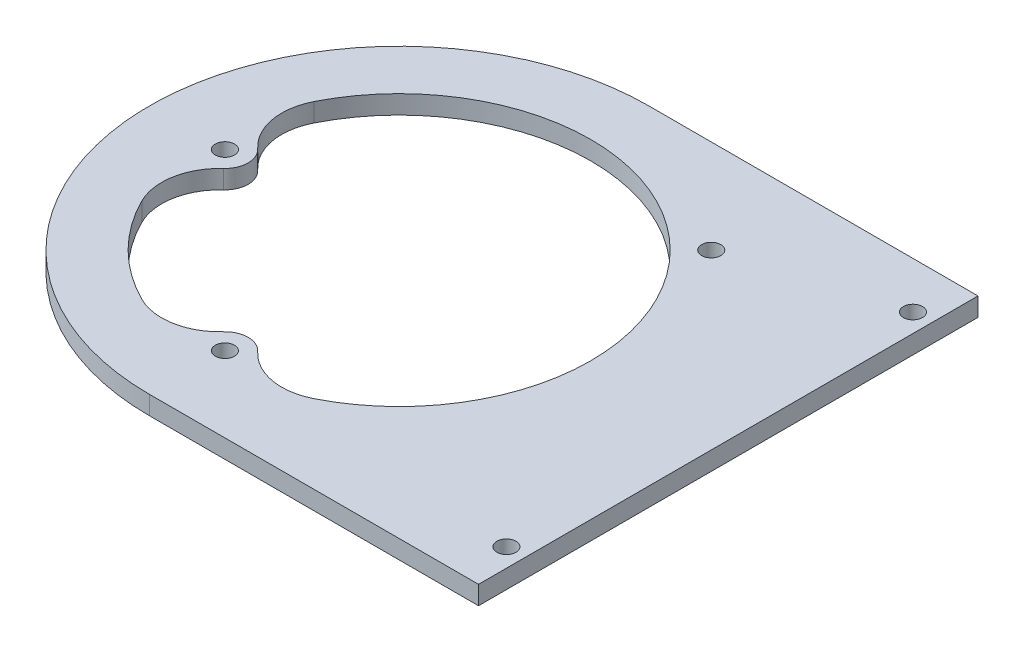
from build123d import *

# Parameters (mm, degrees)
SKETCH1_R           = 1.65
BOSS_EXTRUDE1_DEPTH = 3.2
FILLET1_R           = 10


with BuildPart() as part:
    # Sketch1 → Boss-Extrude1 (new body)
    with BuildSketch(Plane(origin=(0, 0, 0), x_dir=(1, 0, 0), z_dir=(0, 1, 0))):
        with BuildLine():
            Line((0, -43), (56.67, -43))
            Line((56.67, -43), (56.67, 43))
            Line((56.67, 43), (0, 43))
            ThreePointArc((0, 43), (-43, 0), (0, -43))
        make_face()
        with Locations(Location((26.870057685, 26.870057685, 0), (0, 0, 270))):
            Circle(SKETCH1_R, mode=Mode.SUBTRACT)
        with Locations(Location((0, -30, 0), (0, 0, 270))):
            Circle(SKETCH1_R, mode=Mode.SUBTRACT)
        with Locations(Location((53.47, 35, 0), (0, 0, 270))):
            Circle(SKETCH1_R, mode=Mode.SUBTRACT)
        with Locations(Location((53.47, -35, 0), (0, 0, 90))):
            Circle(SKETCH1_R, mode=Mode.SUBTRACT)
        with Locations(Location((-30, 0, 0), (0, 0, 90))):
            Circle(SKETCH1_R, mode=Mode.SUBTRACT)
        with BuildLine():
            Line((-4, -32.756678708), (-4, -30))
            ThreePointArc((-4, -30), (0, -26), (4, -30))
            Line((4, -30), (4, -32.756678708))
            ThreePointArc((4, -32.756678708), (23.334523779, -23.334523779), (32.756678708, -4))
            ThreePointArc((32.756678708, -4), (33, 0), (32.756678708, 4))
            ThreePointArc((32.756678708, 4), (0, 33), (-32.756678708, 4))
            Line((-32.756678708, 4), (-30, 4))
            ThreePointArc((-30, 4), (-26, 0), (-30, -4))
            Line((-30, -4), (-32.756678708, -4))
            ThreePointArc((-32.756678708, -4), (-23.334523779, -23.334523779), (-4, -32.756678708))
        make_face(mode=Mode.SUBTRACT)
    extrude(amount=BOSS_EXTRUDE1_DEPTH)

    # Fillet1
    fillet1_edges = [part.edges().sort_by_distance(p)[0] for p in [
        (4, 1.6, 32.756678708),
        (-32.756678708, 1.6, -4),
        (-32.756678708, 1.6, 4),
        (-4, 1.6, 32.756678708),
    ]]
    fillet(fillet1_edges, radius=FILLET1_R)


solid = part.part
